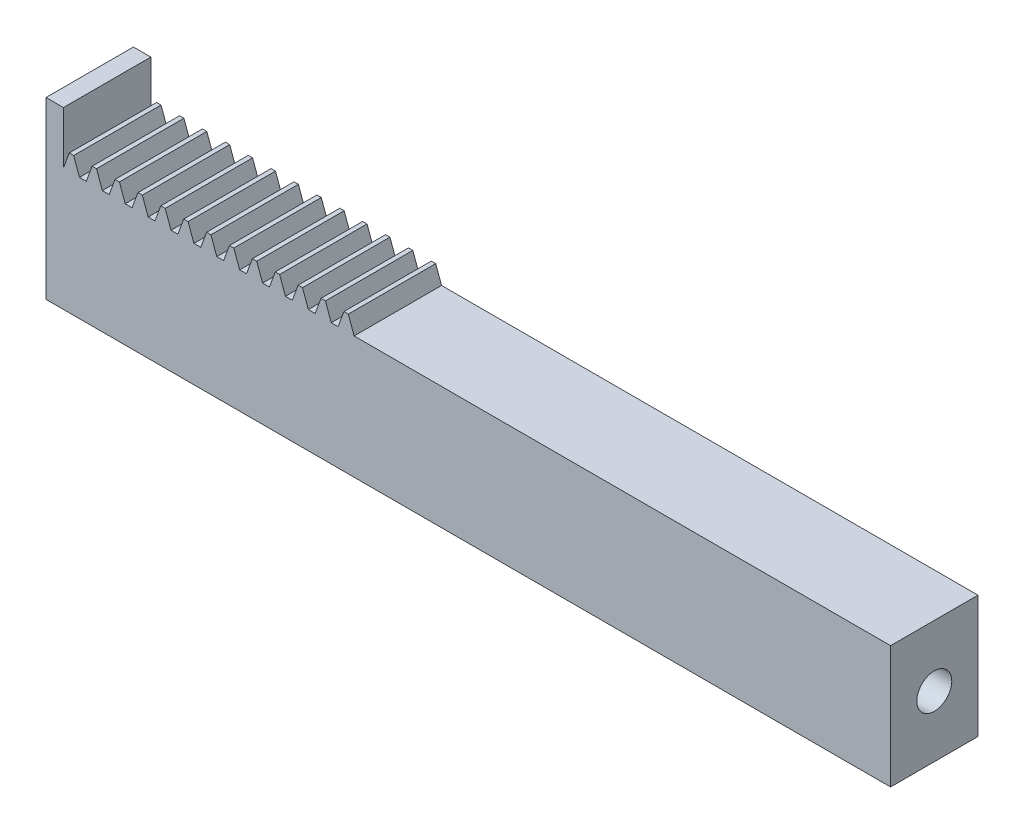
from build123d import *

# Parameters (mm, degrees)
BLANKSKE_W          = 76.2
BLANKSKE_H          = 20.108333333
BLANK_DEPTH         = 12.7
TOOTHCUTSIM_DEPTH   = 80.825278386
TEETHCUTS_COUNT     = 24
TEETHCUTS_PITCH     = 3.324852221
SKETCH1_W           = 12.7
SKETCH1_H           = 17.78
BOSS_EXTRUDE1_DEPTH = 44.45
SKETCH3_R           = 2.54
CUT_EXTRUDE1_DEPTH  = 12.7
SKETCH4_W           = 0.496986858
SKETCH4_H           = 12.7
BOSS_EXTRUDE2_DEPTH = 7.62
SKETCH5_W           = 12.7
SKETCH5_H           = 25.4
BOSS_EXTRUDE3_DEPTH = 2.032
SKETCH6_W           = 12.7
SKETCH6_H           = 2.328333333
CUT_EXTRUDE2_DEPTH  = 76.962


with BuildPart() as part:
    # BlankSke → Blank (new body)
    with BuildSketch(Plane.XY):
        with Locations((38.1, 10.054166667)):
            Rectangle(BLANKSKE_W, BLANKSKE_H)
    extrude(amount=-BLANK_DEPTH)

    # TooCutSkeSim → ToothCutSim (cut, through all)
    with BuildSketch(Plane.XY):
        Polygon((0.496986858, 17.78), (-0.496986858, 17.78), (-1.353675731, 20.133733333), (1.353675731, 20.133733333), align=None)
    toothcutsim = extrude(amount=-TOOTHCUTSIM_DEPTH, mode=Mode.SUBTRACT)

    # TeethCuts: ToothCutSim ×24
    with Locations(*[(i * TEETHCUTS_PITCH, 0, 0) for i in range(1, TEETHCUTS_COUNT)]):
        add(toothcutsim, mode=Mode.SUBTRACT)

    # Sketch1 → Boss-Extrude1 (add)
    with BuildSketch(Plane(origin=(76.2, 0, 0), x_dir=(0, 0, -1), z_dir=(1, 0, 0))):
        with Locations((6.35, 8.89)):
            Rectangle(SKETCH1_W, SKETCH1_H)
    extrude(amount=BOSS_EXTRUDE1_DEPTH)

    # Sketch3 → Cut-Extrude1 (cut)
    with BuildSketch(Plane(origin=(120.65, 0, -120.65), x_dir=(0, 0, 1), z_dir=(-1, 0, 0))):
        with Locations(Location((114.3, 8.89, 0), (0, 0, 90))):
            Circle(SKETCH3_R)
    extrude(amount=CUT_EXTRUDE1_DEPTH, mode=Mode.SUBTRACT)

    # Sketch4 → Boss-Extrude2 (add)
    with BuildSketch(Plane(origin=(0, 17.78, 0), x_dir=(1, 0, 0), z_dir=(0, 1, 0))):
        with Locations((0.248493429, 6.35)):
            Rectangle(SKETCH4_W, SKETCH4_H)
    extrude(amount=BOSS_EXTRUDE2_DEPTH)

    # Sketch5 → Boss-Extrude3 (add)
    with BuildSketch(Plane.ZY):
        with Locations((-6.35, 12.7)):
            Rectangle(SKETCH5_W, SKETCH5_H)
    extrude(amount=BOSS_EXTRUDE3_DEPTH)

    # Sketch6 → Cut-Extrude2 (cut)
    with BuildSketch(Plane(origin=(120.65, 0, 0), x_dir=(0, 0, -1), z_dir=(1, 0, 0))):
        with Locations((6.35, 18.944166667)):
            Rectangle(SKETCH6_W, SKETCH6_H)
    extrude(amount=-CUT_EXTRUDE2_DEPTH, mode=Mode.SUBTRACT)


solid = part.part
